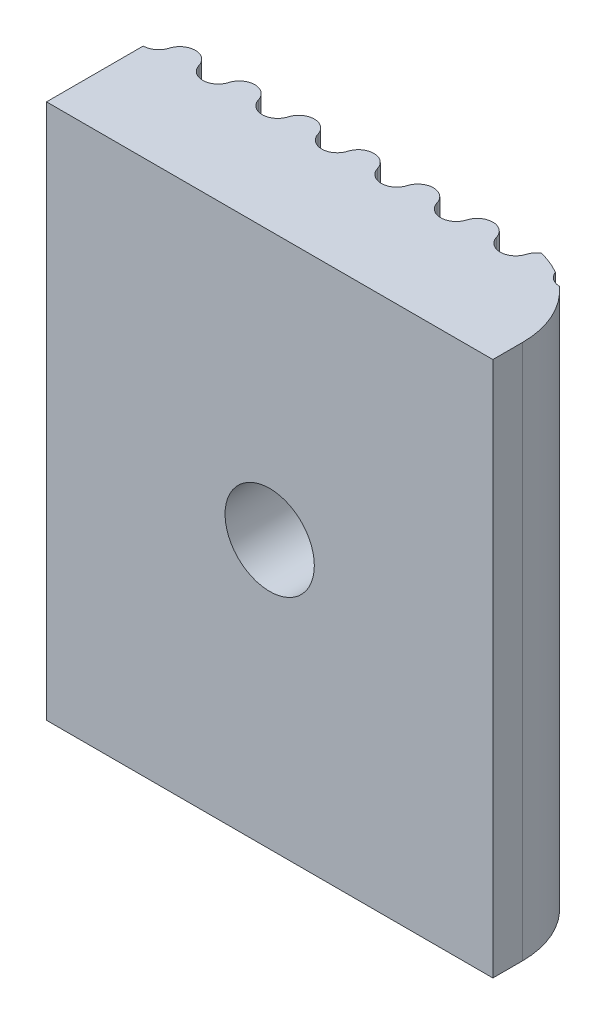
from build123d import *

# Parameters (mm, degrees)
SKETCH1_W           = 15
SKETCH1_H           = 18
SKETCH1_R           = 1.5
BOSS_EXTRUDE1_DEPTH = 4
FILLET1_R           = 3
CUT_EXTRUDE2_DEPTH  = 24.769728648
LPATTERN1_COUNT     = 10
LPATTERN1_PITCH     = 2


with BuildPart() as part:
    # Sketch1 → Boss-Extrude1 (new body)
    with BuildSketch(Plane.XY):
        with Locations((7.5, 9)):
            Rectangle(SKETCH1_W, SKETCH1_H)
        with Locations((7.5, 9)):
            Circle(SKETCH1_R, mode=Mode.SUBTRACT)
    extrude(amount=BOSS_EXTRUDE1_DEPTH)

    # Fillet1
    fillet1_edges = [part.edges().sort_by_distance(p)[0] for p in [
        (15, 9, 0),
    ]]
    fillet(fillet1_edges, radius=FILLET1_R)

    # Sketch2 → Cut-Extrude2 (cut, through all)
    with BuildSketch(Plane(origin=(0, 0, 0), x_dir=(1, 0, 0), z_dir=(0, 1, 0))):
        with BuildLine():
            Line((-1, 0), (1, 0))
            ThreePointArc((1, 0), (0.6875, -0.104166667), (0.5, -0.375))
            ThreePointArc((0.5, -0.375), (0, -0.75), (-0.5, -0.375))
            ThreePointArc((-0.5, -0.375), (-0.6875, -0.104166667), (-1, 0))
        make_face()
    cut_extrude2 = extrude(amount=CUT_EXTRUDE2_DEPTH, mode=Mode.SUBTRACT)

    # LPattern1: Cut-Extrude2 ×10
    with Locations(*[(i * LPATTERN1_PITCH, 0, 0) for i in range(1, LPATTERN1_COUNT)]):
        add(cut_extrude2, mode=Mode.SUBTRACT)


solid = part.part
